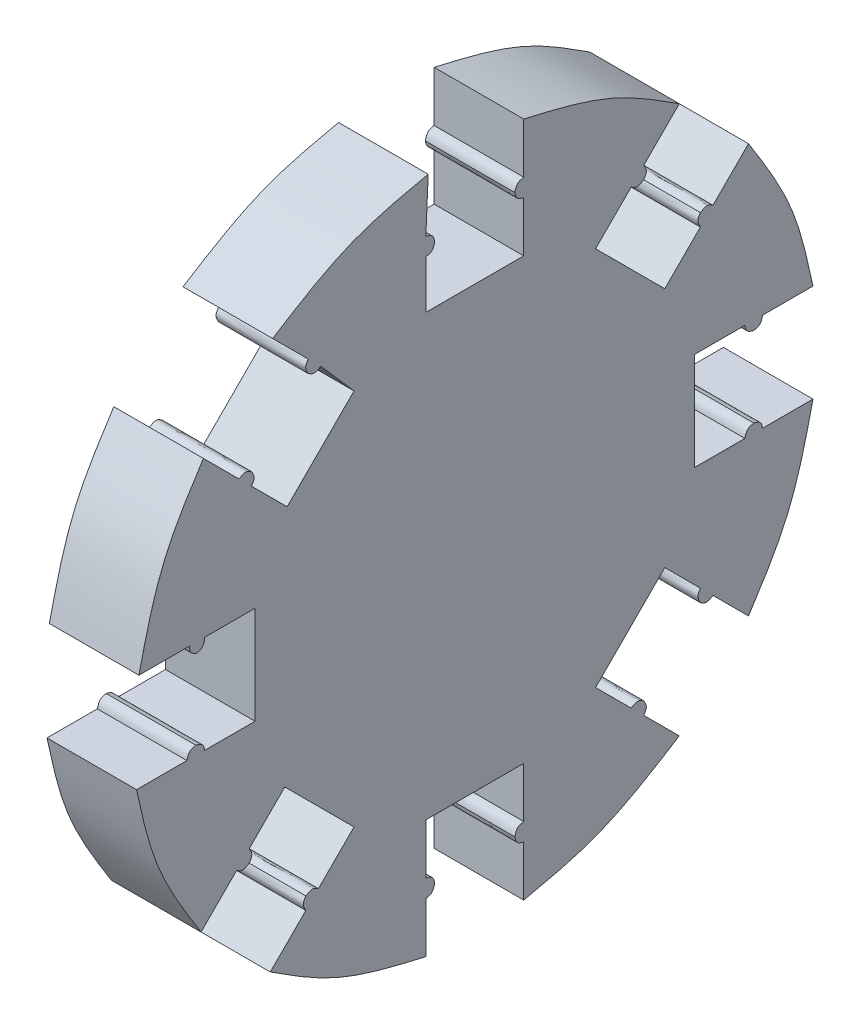
from build123d import *

# Parameters (mm, degrees)
SALIENTE_EXTRUIR1_DEPTH = 2.7


with BuildPart() as part:
    # Croquis1 → Saliente-Extruir1 (new body)
    with BuildSketch(Plane.YZ):
        with BuildLine():
            Line((7.297480923, 4.970431797), (8.369417925, 6.042431452))
            add(Edge.make_bspline(
                [(8.369417925, 6.042431452), (8.875590625, 5.234621129), (9.788327533, 3.77795917), (10.151120591, 2.10149236), (10.312722167, 1.354731436)],
                knots=[0, 0, 0, 0, 0.554562655, 1, 1, 1, 1], degree=3))
            Line((10.312722167, 1.354731436), (8.724770927, 1.425328452))
            add(Edge.make_bspline(
                [(8.724770927, 1.425328452), (8.703422483, 1.344393742), (8.665000992, 1.19938043), (8.520981536, 1.170172839), (8.45699509, 1.157194653)],
                knots=[0, 0, 0, 0, 0.555657086, 1, 1, 1, 1], degree=3))
            add(Edge.make_bspline(
                [(8.45699509, 1.157194653), (8.37641224, 1.178542276), (8.231391468, 1.216960485), (8.20218263, 1.360978884), (8.189204097, 1.425328452)],
                knots=[0, 0, 0, 0, 0.555664194, 1, 1, 1, 1], degree=3))
            Line((8.189204097, 1.425328452), (6.742463066, 1.425328452))
            Line((6.742463066, 1.425328452), (6.742463066, -1.524671548))
            Line((6.742463066, -1.524671548), (8.259902418, -1.524671548))
            add(Edge.make_bspline(
                [(8.259902418, -1.524671548), (8.281312811, -1.444197557), (8.319836422, -1.299354822), (8.463736161, -1.270205781), (8.527693411, -1.257251821)],
                knots=[0, 0, 0, 0, 0.555595638, 1, 1, 1, 1], degree=3))
            add(Edge.make_bspline(
                [(8.527693411, -1.257251821), (8.608213622, -1.278561316), (8.753107352, -1.316907121), (8.782438139, -1.460760318), (8.795469248, -1.524671548)],
                knots=[0, 0, 0, 0, 0.555719084, 1, 1, 1, 1], degree=3))
            Line((8.795469248, -1.524671548), (10.312819338, -1.524671548))
            add(Edge.make_bspline(
                [(10.312819338, -1.524671548), (10.093813606, -2.470272202), (9.705899328, -4.145144871), (8.774893203, -5.585237897), (8.369515095, -6.212282306)],
                knots=[0, 0, 0, 0, 0.564580622, 1, 1, 1, 1], degree=3))
            Line((8.369515095, -6.212282306), (7.297845869, -5.140907476))
            add(Edge.make_bspline(
                [(7.297845869, -5.140907476), (7.225602617, -5.182800716), (7.095908374, -5.25819438), (6.973439447, -5.176989885), (6.919024304, -5.140907476)],
                knots=[0, 0, 0, 0, 0.555659954, 1, 1, 1, 1], degree=3))
            add(Edge.make_bspline(
                [(6.919024304, -5.140907476), (6.877134307, -5.068857561), (6.801735176, -4.93917264), (6.882934654, -4.816700577), (6.919021598, -4.762092615)],
                knots=[0, 0, 0, 0, 0.555576659, 1, 1, 1, 1], degree=3))
            Line((6.919021598, -4.762092615), (5.845924189, -3.688932611))
            Line((5.845924189, -3.688932611), (3.759932093, -5.774870524))
            Line((3.759932093, -5.774870524), (4.833118759, -6.848119791))
            add(Edge.make_bspline(
                [(4.833118759, -6.848119791), (4.905168958, -6.806298261), (5.03484056, -6.731029361), (5.157270737, -6.812157845), (5.211688122, -6.848209049)],
                knots=[0, 0, 0, 0, 0.555628277, 1, 1, 1, 1], degree=3))
            add(Edge.make_bspline(
                [(5.211688122, -6.848209049), (5.253581525, -6.920262709), (5.328962068, -7.049911853), (5.247813874, -7.172359743), (5.211764507, -7.226756134)],
                knots=[0, 0, 0, 0, 0.555758851, 1, 1, 1, 1], degree=3))
            Line((5.211764507, -7.226756134), (6.283165951, -8.298130963))
            add(Edge.make_bspline(
                [(6.283165951, -8.298130963), (5.47535536, -8.80411635), (4.018696182, -9.716510057), (2.342386574, -10.079267858), (1.595706532, -10.24085138)],
                knots=[0, 0, 0, 0, 0.554569134, 1, 1, 1, 1], degree=3))
            Line((1.595706532, -10.24085138), (1.595706532, -8.724699347))
            add(Edge.make_bspline(
                [(1.595706532, -8.724699347), (1.515116241, -8.703355974), (1.37007833, -8.664948354), (1.340890897, -8.520915436), (1.327930638, -8.456922584)],
                knots=[0, 0, 0, 0, 0.555706756, 1, 1, 1, 1], degree=3))
            add(Edge.make_bspline(
                [(1.327930638, -8.456922584), (1.349263068, -8.376344398), (1.387659123, -8.231312419), (1.53169529, -8.202119481), (1.595706532, -8.189145821)],
                knots=[0, 0, 0, 0, 0.555589098, 1, 1, 1, 1], degree=3))
            Line((1.595706532, -8.189145821), (1.595706532, -6.671387127))
            Line((1.595706532, -6.671387127), (-1.354293468, -6.671387127))
            Line((-1.354293468, -6.671387127), (-1.354293468, -8.189145821))
            add(Edge.make_bspline(
                [(-1.354293468, -8.189145821), (-1.273710583, -8.210494727), (-1.128696316, -8.248916136), (-1.099488505, -8.392930149), (-1.086503804, -8.456922584)],
                knots=[0, 0, 0, 0, 0.555651333, 1, 1, 1, 1], degree=3))
            add(Edge.make_bspline(
                [(-1.086503804, -8.456922584), (-1.107855074, -8.537500239), (-1.146280163, -8.682512852), (-1.290299751, -8.711720992), (-1.354293468, -8.724699347)],
                knots=[0, 0, 0, 0, 0.55565963, 1, 1, 1, 1], degree=3))
            Line((-1.354293468, -8.724699347), (-1.354293468, -10.241565452))
            add(Edge.make_bspline(
                [(-1.354293468, -10.241565452), (-2.299915842, -10.022574395), (-3.974848679, -9.634688932), (-5.415023928, -8.70375093), (-6.04210993, -8.29839874)],
                knots=[0, 0, 0, 0, 0.564576601, 1, 1, 1, 1], degree=3))
            Line((-6.04210993, -8.29839874), (-4.970440704, -7.226756134))
            add(Edge.make_bspline(
                [(-4.970440704, -7.226756134), (-5.012285847, -7.154721388), (-5.087632243, -7.025054528), (-5.006438882, -6.902624611), (-4.970337126, -6.848209049)],
                knots=[0, 0, 0, 0, 0.555537056, 1, 1, 1, 1], degree=3))
            add(Edge.make_bspline(
                [(-4.970337126, -6.848209049), (-4.898298837, -6.806350961), (-4.768663007, -6.73102563), (-4.646203871, -6.812098777), (-4.591794955, -6.848119791)],
                knots=[0, 0, 0, 0, 0.555697367, 1, 1, 1, 1], degree=3))
            Line((-4.591794955, -6.848119791), (-3.518612952, -5.774865861))
            Line((-3.518612952, -5.774865861), (-5.604605356, -3.688928255))
            Line((-5.604605356, -3.688928255), (-6.677693443, -4.762088263))
            add(Edge.make_bspline(
                [(-6.677693443, -4.762088263), (-6.635799171, -4.834341514), (-6.560411879, -4.964037498), (-6.641622539, -5.086496925), (-6.677693443, -5.140903124)],
                knots=[0, 0, 0, 0, 0.555720619, 1, 1, 1, 1], degree=3))
            add(Edge.make_bspline(
                [(-6.677693443, -5.140903124), (-6.74976218, -5.182796907), (-6.879459593, -5.25819042), (-7.001930707, -5.176985186), (-7.056527032, -5.140903124)],
                knots=[0, 0, 0, 0, 0.555668272, 1, 1, 1, 1], degree=3))
            Line((-7.056527032, -5.140903124), (-8.128017736, -6.212099436))
            add(Edge.make_bspline(
                [(-8.128017736, -6.212099436), (-8.634008676, -5.404289238), (-9.546437286, -3.947641104), (-9.909200159, -2.271343896), (-10.070786412, -1.524667196)],
                knots=[0, 0, 0, 0, 0.554567832, 1, 1, 1, 1], degree=3))
            Line((-10.070786412, -1.524667196), (-8.554150411, -1.524667196))
            add(Edge.make_bspline(
                [(-8.554150411, -1.524667196), (-8.532750864, -1.444192707), (-8.49425019, -1.299331784), (-8.35033367, -1.270197018), (-8.286354966, -1.257247468)],
                knots=[0, 0, 0, 0, 0.555529311, 1, 1, 1, 1], degree=3))
            add(Edge.make_bspline(
                [(-8.286354966, -1.257247468), (-8.205836617, -1.2785574), (-8.060945098, -1.316904292), (-8.031614662, -1.460755998), (-8.018583581, -1.524667196)],
                knots=[0, 0, 0, 0, 0.555714708, 1, 1, 1, 1], degree=3))
            Line((-8.018583581, -1.524667196), (-6.501144229, -1.524667196))
            Line((-6.501144229, -1.524667196), (-6.501144229, 1.425332804))
            Line((-6.501144229, 1.425332804), (-8.018583581, 1.425332804))
            add(Edge.make_bspline(
                [(-8.018583581, 1.425332804), (-8.039924562, 1.344398136), (-8.078353898, 1.199386347), (-8.222373642, 1.170177561), (-8.286354966, 1.157199005)],
                knots=[0, 0, 0, 0, 0.555662633, 1, 1, 1, 1], degree=3))
            add(Edge.make_bspline(
                [(-8.286354966, 1.157199005), (-8.366955093, 1.178542009), (-8.511994879, 1.216948705), (-8.541182608, 1.360982888), (-8.554150411, 1.425332804)],
                knots=[0, 0, 0, 0, 0.555710462, 1, 1, 1, 1], degree=3))
            Line((-8.554150411, 1.425332804), (-10.071500501, 1.425332804))
            add(Edge.make_bspline(
                [(-10.071500501, 1.425332804), (-9.852483919, 2.370936701), (-9.46456756, 4.045833081), (-8.533574372, 5.485963436), (-8.128196258, 6.113032821)],
                knots=[0, 0, 0, 0, 0.564574566, 1, 1, 1, 1], degree=3))
            Line((-8.128196258, 6.113032821), (-7.056169987, 5.041122438))
            add(Edge.make_bspline(
                [(-7.056169987, 5.041122438), (-6.984112859, 5.082892269), (-6.854460766, 5.15806352), (-6.732080794, 5.076974727), (-6.677693443, 5.04094392)],
                knots=[0, 0, 0, 0, 0.555662318, 1, 1, 1, 1], degree=3))
            add(Edge.make_bspline(
                [(-6.677693443, 5.04094392), (-6.635817307, 4.96892276), (-6.560465333, 4.839327791), (-6.641516485, 4.716883255), (-6.677524238, 4.662486094)],
                knots=[0, 0, 0, 0, 0.555740396, 1, 1, 1, 1], degree=3))
            Line((-6.677524238, 4.662486094), (-5.604605356, 3.589593863))
            Line((-5.604605356, 3.589593863), (-3.518616198, 5.675534716))
            Line((-3.518616198, 5.675534716), (-4.591445825, 6.748337693))
            add(Edge.make_bspline(
                [(-4.591445825, 6.748337693), (-4.663681512, 6.70644368), (-4.79338027, 6.631050231), (-4.915852314, 6.712255779), (-4.970255779, 6.748337693)],
                knots=[0, 0, 0, 0, 0.555671803, 1, 1, 1, 1], degree=3))
            add(Edge.make_bspline(
                [(-4.970255779, 6.748337693), (-5.012151001, 6.820387283), (-5.087558954, 6.950070619), (-5.006357548, 7.072544368), (-4.970091574, 7.127152554)],
                knots=[0, 0, 0, 0, 0.555580943, 1, 1, 1, 1], degree=3))
            Line((-4.970091574, 7.127152554), (-6.041850048, 8.19879517))
            add(Edge.make_bspline(
                [(-6.041850048, 8.19879517), (-5.234024914, 8.704780315), (-3.777337907, 9.617188173), (-2.101006142, 9.979995878), (-1.354301369, 10.141604846)],
                knots=[0, 0, 0, 0, 0.554560268, 1, 1, 1, 1], degree=3))
            Line((-1.354301369, 10.141604846), (-1.354301369, 8.624649482))
            add(Edge.make_bspline(
                [(-1.354301369, 8.624649482), (-1.273718485, 8.603300575), (-1.128704218, 8.564879167), (-1.099496406, 8.420865154), (-1.086511705, 8.356872719)],
                knots=[0, 0, 0, 0, 0.555651333, 1, 1, 1, 1], degree=3))
            add(Edge.make_bspline(
                [(-1.086511705, 8.356872719), (-1.107862976, 8.276295064), (-1.146288064, 8.13128245), (-1.290307652, 8.102074311), (-1.354301369, 8.089095956)],
                knots=[0, 0, 0, 0, 0.55565963, 1, 1, 1, 1], degree=3))
            Line((-1.354301369, 8.089095956), (-1.354301369, 6.572051333))
            Line((-1.354301369, 6.572051333), (1.595698631, 6.572051333))
            Line((1.595698631, 6.572051333), (1.595698631, 8.089095956))
            add(Edge.make_bspline(
                [(1.595698631, 8.089095956), (1.513080901, 8.100260421), (1.364394708, 8.120349145), (1.317537067, 8.259639307), (1.296725996, 8.321525919)],
                knots=[0, 0, 0, 0, 0.555706756, 1, 1, 1, 1], degree=3))
            add(Edge.make_bspline(
                [(1.296725996, 8.321525919), (1.327905122, 8.398829081), (1.384024159, 8.537966371), (1.530571428, 8.54903629), (1.595698631, 8.553955883)],
                knots=[0, 0, 0, 0, 0.555589098, 1, 1, 1, 1], degree=3))
            Line((1.595698631, 8.553955883), (1.595698631, 10.070911247))
            add(Edge.make_bspline(
                [(1.595698631, 10.070911247), (2.541244453, 9.851952213), (4.216014902, 9.464124028), (5.656108687, 8.533372019), (6.283158049, 8.128101571)],
                knots=[0, 0, 0, 0, 0.564577412, 1, 1, 1, 1], degree=3))
            Line((6.283158049, 8.128101571), (5.211488823, 7.056369706))
            add(Edge.make_bspline(
                [(5.211488823, 7.056369706), (5.253572892, 6.984116355), (5.32895748, 6.854419885), (5.247747411, 6.731960974), (5.21168022, 6.677554845)],
                knots=[0, 0, 0, 0, 0.555719308, 1, 1, 1, 1], degree=3))
            add(Edge.make_bspline(
                [(5.21168022, 6.677554845), (5.139610243, 6.635660825), (5.009911447, 6.560267378), (4.887439378, 6.641472934), (4.832843074, 6.677554845)],
                knots=[0, 0, 0, 0, 0.555671902, 1, 1, 1, 1], degree=3))
            Line((4.832843074, 6.677554845), (3.759924191, 5.604841131))
            Line((3.759924191, 5.604841131), (5.775225872, 3.589589511))
            Line((5.775225872, 3.589589511), (6.918835174, 4.591795454))
            add(Edge.make_bspline(
                [(6.918835174, 4.591795454), (6.877037667, 4.663828591), (6.801793565, 4.793481942), (6.88294748, 4.915864384), (6.919016403, 4.970253279)],
                knots=[0, 0, 0, 0, 0.555582533, 1, 1, 1, 1], degree=3))
            add(Edge.make_bspline(
                [(6.919016403, 4.970253279), (6.991026343, 5.012093272), (7.120613018, 5.087387122), (7.243071375, 5.006410548), (7.297480923, 4.970431797)],
                knots=[0, 0, 0, 0, 0.555689383, 1, 1, 1, 1], degree=3))
        make_face()
    extrude(amount=SALIENTE_EXTRUIR1_DEPTH)


solid = part.part
